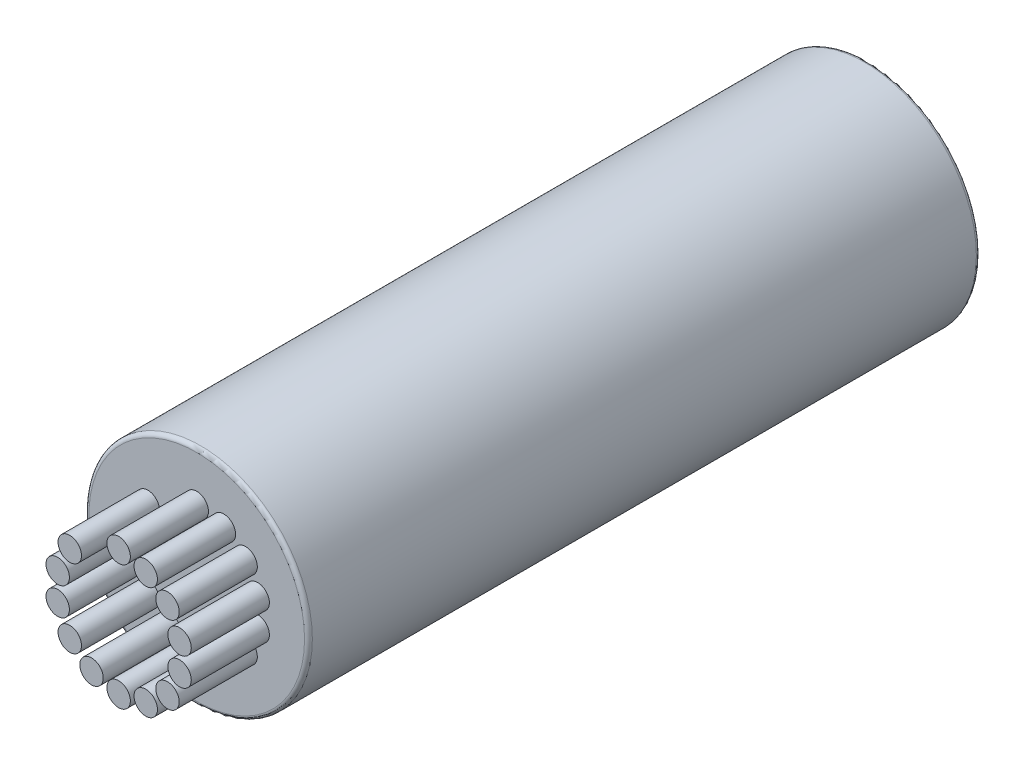
from build123d import *

# Parameters (mm, degrees)
SKETCH1_R           = 7.15
BOSS_EXTRUDE1_DEPTH = 43
SKETCH2_R           = 5
CUT_EXTRUDE1_DEPTH  = 0.1
SKETCH3_R           = 0.75
BOSS_EXTRUDE2_DEPTH = 5
FILLET1_R           = 0.25


with BuildPart() as part:
    # Sketch1 → Boss-Extrude1 (new body)
    with BuildSketch(Plane.XY):
        Circle(SKETCH1_R)
    extrude(amount=BOSS_EXTRUDE1_DEPTH)

    # Sketch2 → Cut-Extrude1 (cut)
    with BuildSketch(Plane(origin=(0, 0, 0), x_dir=(-1, 0, 0), z_dir=(0, 0, -1))):
        Circle(SKETCH2_R)
    extrude(amount=-CUT_EXTRUDE1_DEPTH, mode=Mode.SUBTRACT)

    # Sketch3 → Boss-Extrude2 (add)
    with BuildSketch(Plane.XY.offset(43)):
        with Locations((0, 4)):
            Circle(SKETCH3_R)
        with Locations((1.735534956, 3.603875472)):
            Circle(SKETCH3_R)
        with Locations((3.12732593, 2.493959207)):
            Circle(SKETCH3_R)
        with Locations((3.899711649, 0.890083736)):
            Circle(SKETCH3_R)
        with Locations((3.899711649, -0.890083736)):
            Circle(SKETCH3_R)
        with Locations((3.12732593, -2.493959207)):
            Circle(SKETCH3_R)
        with Locations((1.735534956, -3.603875472)):
            Circle(SKETCH3_R)
        with Locations((0, -4)):
            Circle(SKETCH3_R)
        with Locations((-1.735534956, -3.603875472)):
            Circle(SKETCH3_R)
        with Locations((-3.12732593, -2.493959207)):
            Circle(SKETCH3_R)
        with Locations((-3.899711649, -0.890083736)):
            Circle(SKETCH3_R)
        with Locations((-3.899711649, 0.890083736)):
            Circle(SKETCH3_R)
        with Locations((-3.12732593, 2.493959207)):
            Circle(SKETCH3_R)
    extrude(amount=BOSS_EXTRUDE2_DEPTH)

    # Fillet1
    fillet1_edges = [part.edges().sort_by_distance(p)[0] for p in [
        (-7.15, 0, 0),
        (-7.15, 0, 43),
    ]]
    fillet(fillet1_edges, radius=FILLET1_R)


solid = part.part
